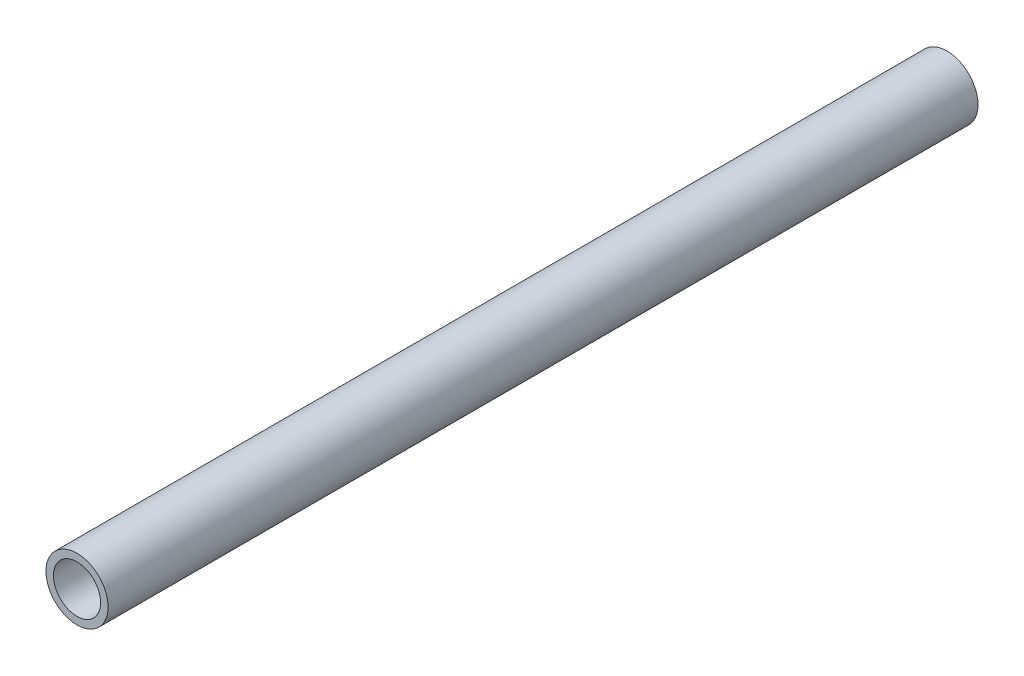
from build123d import *

# Parameters (mm, degrees)
SKETCH1_R           = 12.5
SKETCH1_R_2         = 9.5
EXTRUDE_THIN1_DEPTH = 175


with BuildPart() as part:
    # Sketch1 → Extrude-Thin1 (new, symmetric)
    with BuildSketch(Plane.XY):
        Circle(SKETCH1_R)
        Circle(SKETCH1_R_2, mode=Mode.SUBTRACT)
    extrude(amount=EXTRUDE_THIN1_DEPTH, both=True)


solid = part.part
